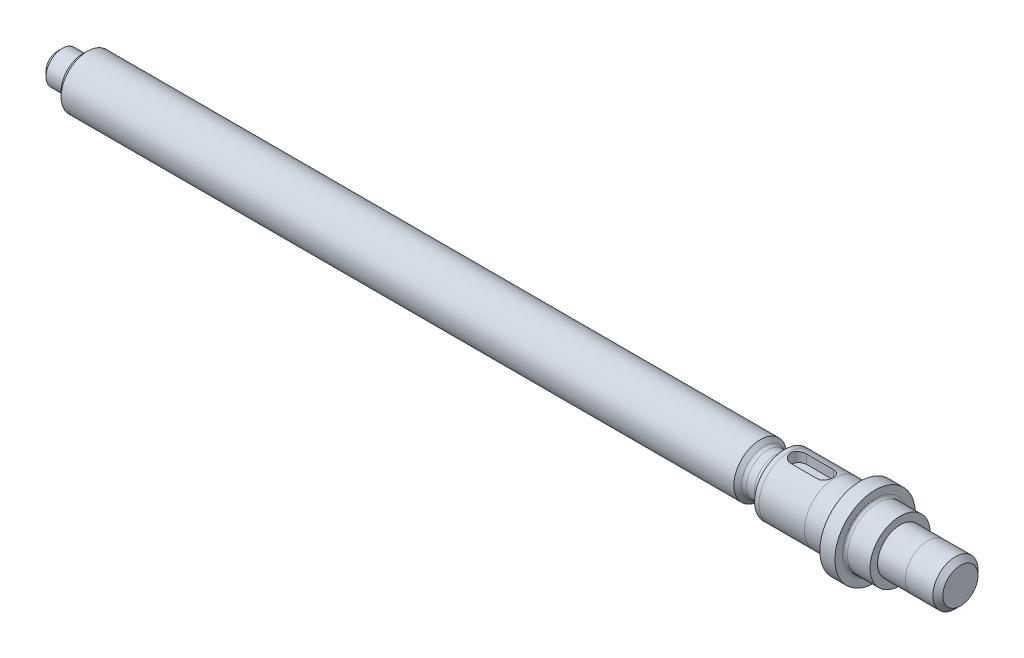
from build123d import *

# Parameters (mm, degrees)
FILLET_1_R          = 0.5
FILLET_2_R          = 0.5
FILLET_3_R          = 1
FILLET_4_R          = 0.5
CHAMFER_1_SIZE      = 1
CHAMFER_2_SIZE      = 1
CUT_EXTRUDE_1_DEPTH = 6


with BuildPart() as part:
    # Эскиз1 → Повернуть1 (revolve)
    with BuildSketch(Plane(origin=(0, 0, 0), x_dir=(1, 0, 0), z_dir=(0, 1, 0)), mode=Mode.PRIVATE) as revolve_1_sk:
        with BuildLine():
            Line((55.756411679, -2.497269463), (55.756411679, -6.997269463))
            Line((55.756411679, -6.997269463), (43.756411679, -6.997269463))
            Line((43.756411679, -6.997269463), (43.756411679, -8.497269463))
            Line((43.756411679, -8.497269463), (38.756411679, -8.497269463))
            Line((38.756411679, -8.497269463), (38.756411679, -10.497269463))
            Line((38.756411679, -10.497269463), (35.756411679, -10.497269463))
            Line((35.756411679, -10.497269463), (35.756411679, -8.497269463))
            Line((35.756411679, -8.497269463), (20.756411679, -8.497269463))
            ThreePointArc((20.756411679, -8.497269463), (20.229203885, -7.224477257), (18.956411679, -6.697269463))
            Line((18.956411679, -6.697269463), (16.956411679, -6.697269463))
            Line((16.956411679, -6.697269463), (15.895751507, -7.757929635))
            Line((15.895751507, -7.757929635), (-119.089435131, -7.757929635))
            Line((-119.089435131, -7.757929635), (-119.089435131, -5.757929635))
            Line((-119.089435131, -5.757929635), (-124.089435131, -5.757929635))
            Line((-124.089435131, -5.757929635), (-124.089435131, -2.497269463))
            Line((-124.089435131, -2.497269463), (55.756411679, -2.497269463))
        make_face()
    revolve(revolve_1_sk.sketch.rotate(Axis((55.756411679, 0, 2.497269463), (-1, 0, 0)), 180), axis=Axis((55.756411679, 0, 2.497269463), (-1, 0, 0)))

    # Скругление1
    fillet_1_edges = [part.edges().sort_by_distance(p)[0] for p in [
        (35.756411679, 0, 8.497269463),
    ]]
    fillet(fillet_1_edges, radius=FILLET_1_R)

    # Скругление2
    fillet_2_edges = [part.edges().sort_by_distance(p)[0] for p in [
        (38.756411679, 0, 8.497269463),
    ]]
    fillet(fillet_2_edges, radius=FILLET_2_R)

    # Скругление3
    fillet_3_edges = [part.edges().sort_by_distance(p)[0] for p in [
        (16.956411679, 0, 6.697269463),
    ]]
    fillet(fillet_3_edges, radius=FILLET_3_R)

    # Скругление4
    fillet_4_edges = [part.edges().sort_by_distance(p)[0] for p in [
        (-119.089435131, 0, 5.757929635),
    ]]
    fillet(fillet_4_edges, radius=FILLET_4_R)

    # Фаска1
    chamfer_1_edges = [part.edges().sort_by_distance(p)[0] for p in [
        (55.756411679, 0, 6.997269463),
        (-119.089435131, 0, 7.757929635),
    ]]
    chamfer(chamfer_1_edges, length=CHAMFER_1_SIZE)

    # Фаска2
    chamfer_2_edges = [part.edges().sort_by_distance(p)[0] for p in [
        (-124.089435131, 0, 5.757929635),
    ]]
    chamfer(chamfer_2_edges, length=CHAMFER_2_SIZE)

    # Эскиз2 → Вырез-Вытянуть1 (cut)
    with BuildSketch(Plane(origin=(0, 10, 0), x_dir=(1, 0, 0), z_dir=(0, 1, 0))):
        with BuildLine():
            Line((23.550856254, -0.902866319), (28.868398961, -0.902866319))
            ThreePointArc((28.868398961, -0.902866319), (30.462802104, -2.497269463), (28.868398961, -4.091672607))
            Line((28.868398961, -4.091672607), (23.550856254, -4.091672607))
            ThreePointArc((23.550856254, -4.091672607), (21.95645311, -2.497269463), (23.550856254, -0.902866319))
        make_face()
    extrude(amount=-CUT_EXTRUDE_1_DEPTH, mode=Mode.SUBTRACT)


solid = part.part
